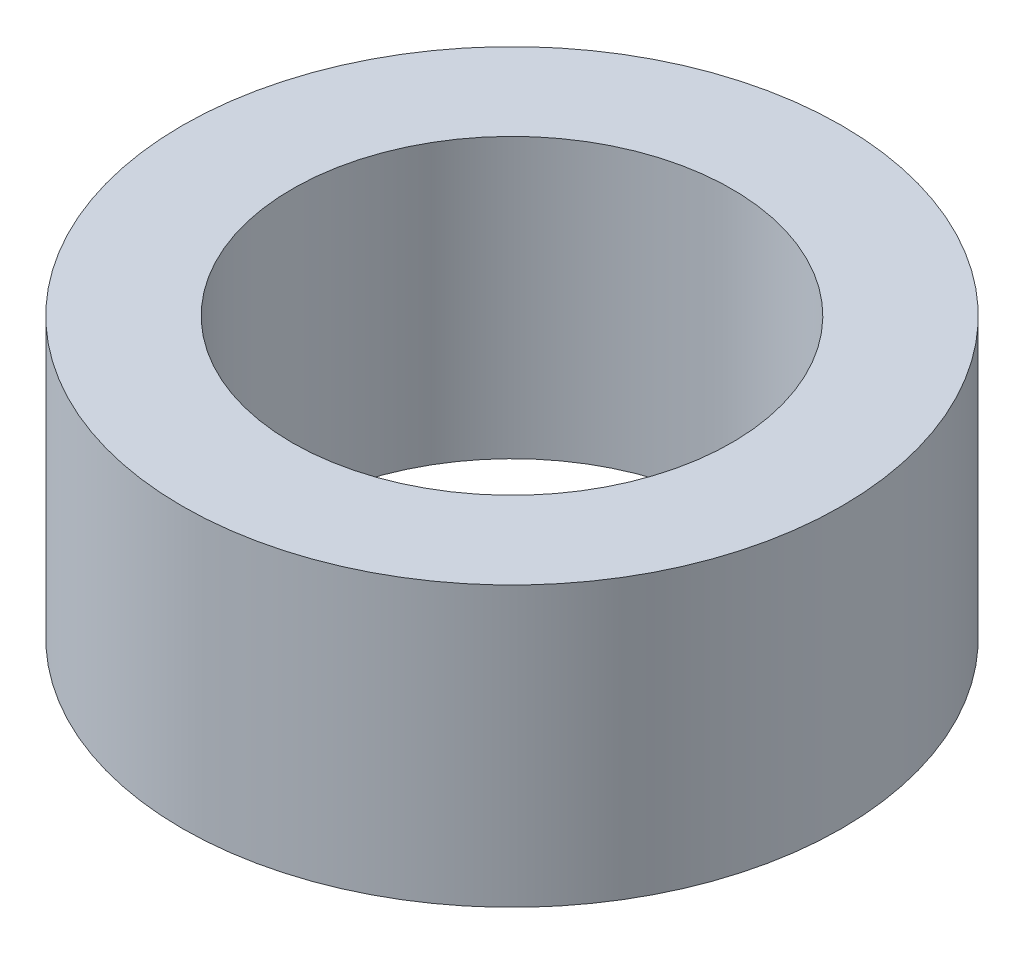
from build123d import *

# Parameters (mm, degrees)
SKETCH1_R           = 15
SKETCH1_R_2         = 10
BOSS_EXTRUDE1_DEPTH = 12.7


with BuildPart() as part:
    # Sketch1 → Boss-Extrude1 (new body)
    with BuildSketch(Plane(origin=(0, 0, 0), x_dir=(1, 0, 0), z_dir=(0, 1, 0))):
        with Locations(Location((0, 0, 0), (0, 0, 270))):
            Circle(SKETCH1_R)
        with Locations(Location((0, 0, 0), (0, 0, 270))):
            Circle(SKETCH1_R_2, mode=Mode.SUBTRACT)
    extrude(amount=BOSS_EXTRUDE1_DEPTH)


solid = part.part
